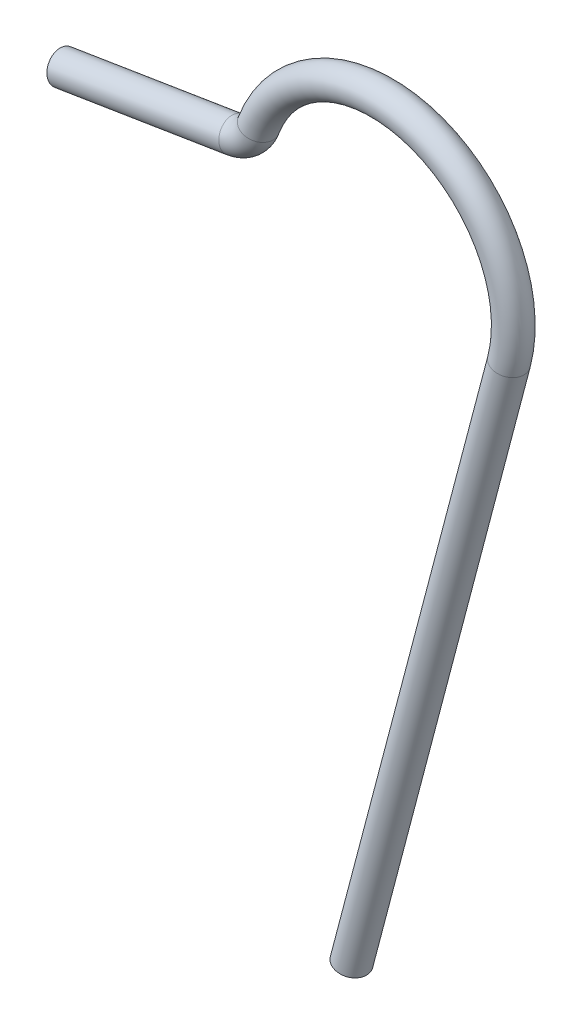
from build123d import *

# Parameters (mm, degrees)
CROQUIS2_R = 0.1


with BuildPart() as part:
    # Barrer1: sweep along a path in Croquis1
    with BuildLine(Plane.XY) as barrer1_path:
        Line((-3.60111474, -0.218307583), (-2.490273597, -0.039052328))
        ThreePointArc((-2.490273597, -0.039052328), (-2.395364241, 0.003703054), (-2.334796535, 0.088363324))
        ThreePointArc((-2.334796535, 0.088363324), (-1.28134302, 0.600868075), (-0.716575777, -0.425515571))
        Line((-0.716575777, -0.425515571), (-1.734226771, -4.293898496))
    # Croquis2 → Barrer1 (sweep)
    with BuildSketch(Plane(origin=(-3.60111474, -0.218307583, 0), x_dir=(0, 0, -1), z_dir=(0.9872289173198326, 0.1593080814256168, 0))):
        Circle(CROQUIS2_R)
    sweep(path=barrer1_path.line)


solid = part.part
